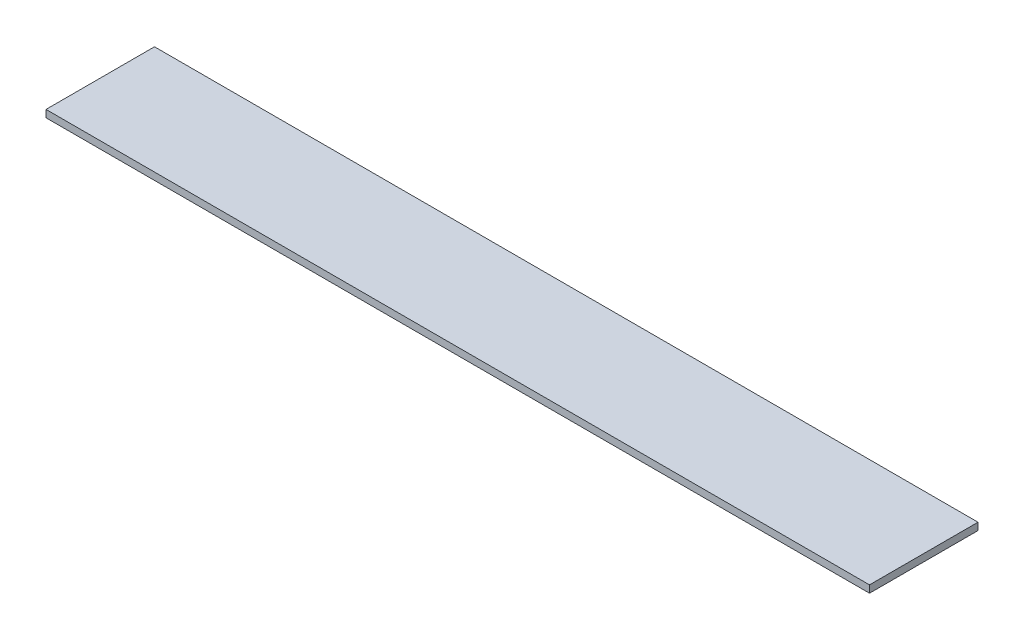
from build123d import *

# Parameters (mm, degrees)
SKETCH2_W           = 539.75
SKETCH2_H           = 71.12
BOSS_EXTRUDE1_DEPTH = 4.7625


with BuildPart() as part:
    # Sketch2 → Boss-Extrude1 (new body)
    with BuildSketch(Plane(origin=(0, 0, 0), x_dir=(1, 0, 0), z_dir=(0, 1, 0))):
        with Locations((269.875, 35.56)):
            Rectangle(SKETCH2_W, SKETCH2_H)
    extrude(amount=BOSS_EXTRUDE1_DEPTH)


solid = part.part
